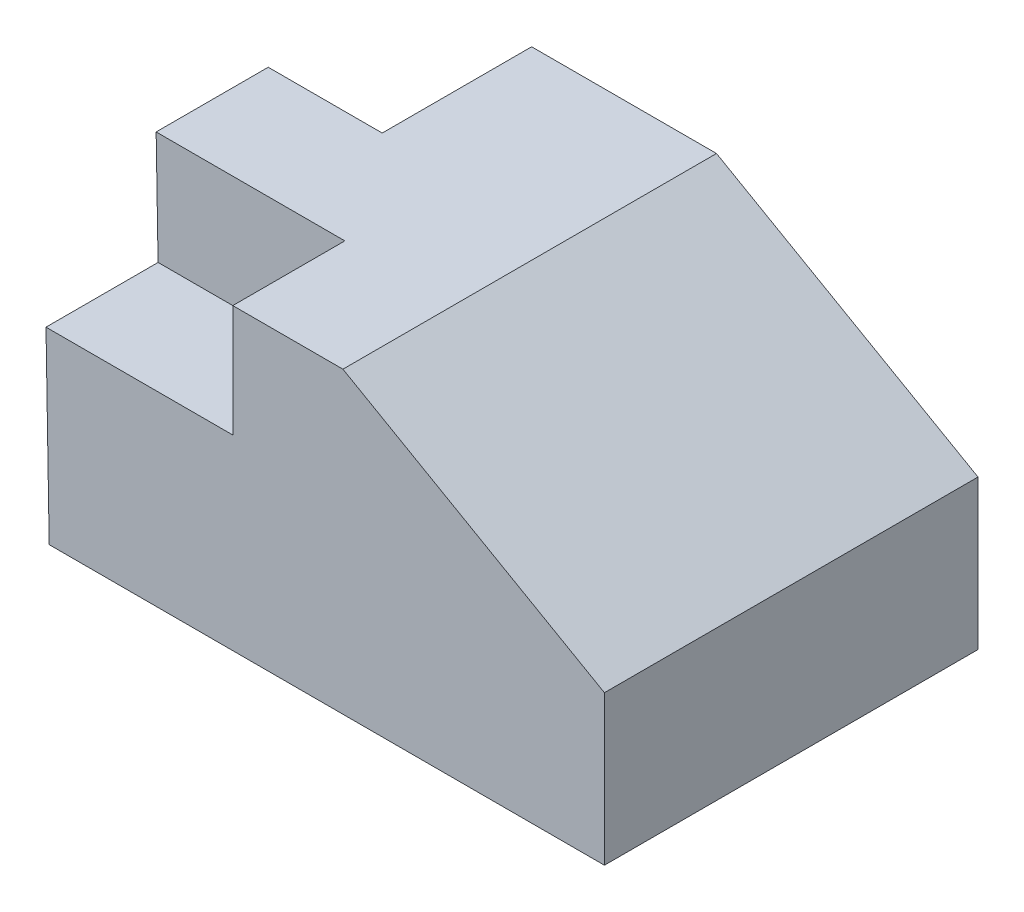
from build123d import *

# Parameters (mm, degrees)
BOSS_EXTRUDE1_DEPTH = 100
CUT_EXTRUDE1_DEPTH  = 30
CUT_EXTRUDE2_DEPTH  = 40
SKETCH5_W           = 30
SKETCH5_H           = 40
CUT_EXTRUDE3_DEPTH  = 188.082869339


with BuildPart() as part:
    # Sketch1 → Boss-Extrude1 (new body)
    with BuildSketch(Plane.XY):
        Polygon((1.371761587, 0), (150, 0), (150, 40), (80, 80), (0, 80), align=None)
    extrude(amount=-BOSS_EXTRUDE1_DEPTH)

    # Sketch2 → Cut-Extrude1 (cut)
    with BuildSketch(Plane.XY):
        Polygon((0, 80), (0.514410595, 50), (50.514410595, 50), (50.514410595, 80), align=None)
    extrude(amount=-CUT_EXTRUDE1_DEPTH, mode=Mode.SUBTRACT)

    # Sketch3 → Cut-Extrude2 (cut)
    with BuildSketch(Plane(origin=(0, 0, -100), x_dir=(-1, 0, 0), z_dir=(0, 0, -1))):
        Polygon((0, 80), (-30.514410595, 80), (-30.514410595, 50), (-0.514410595, 50), align=None)
    extrude(amount=-CUT_EXTRUDE2_DEPTH, mode=Mode.SUBTRACT)

    # Sketch5 → Cut-Extrude3 (cut, through all)
    with BuildSketch(Plane(origin=(0, 50, 0), x_dir=(1, 0, 0), z_dir=(0, 1, 0))):
        with Locations((15.514410595, 80)):
            Rectangle(SKETCH5_W, SKETCH5_H)
    extrude(amount=-CUT_EXTRUDE3_DEPTH, mode=Mode.SUBTRACT)


solid = part.part
